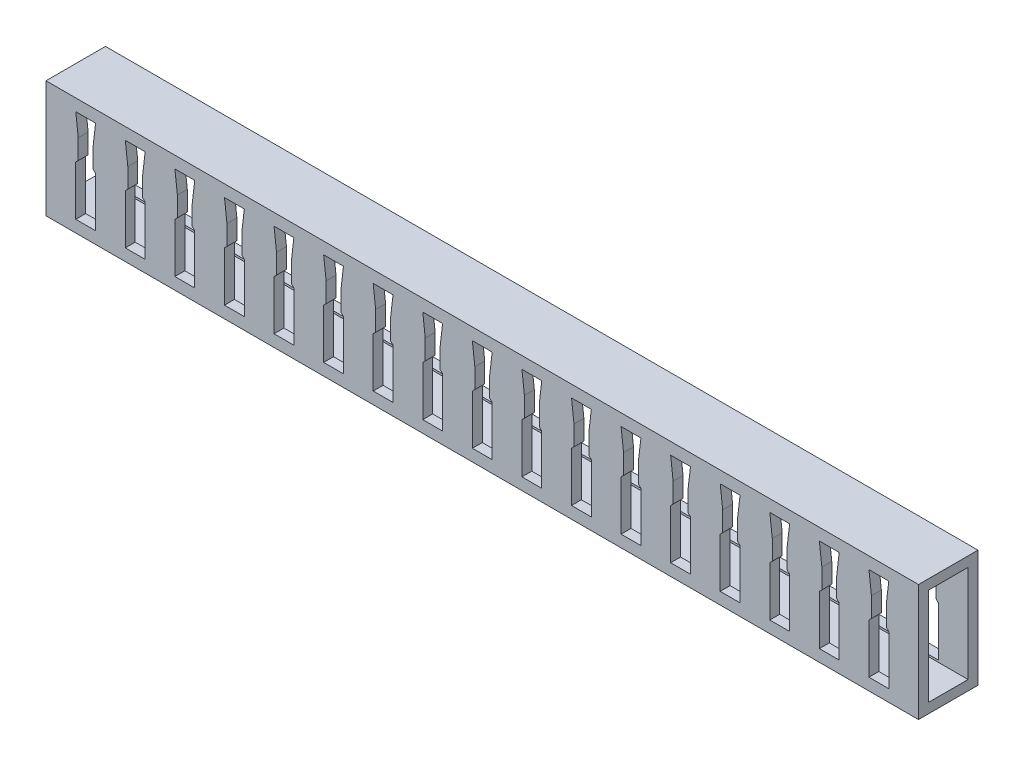
from build123d import *

# Parameters (mm, degrees)
SKETCH2_W           = 15.24
SKETCH2_H           = 29.972
BOSS_EXTRUDE1_DEPTH = 223.52
SKETCH3_W           = 10.16
SKETCH3_H           = 24.892
CUT_EXTRUDE1_DEPTH  = 419.1
CUT_EXTRUDE2_DEPTH  = 419.1


with BuildPart() as part:
    # Sketch2 → Boss-Extrude1 (new body)
    with BuildSketch(Plane(origin=(0, 0, 0), x_dir=(0, 0, -1), z_dir=(1, 0, 0))):
        with Locations((7.62, 14.986)):
            Rectangle(SKETCH2_W, SKETCH2_H)
    extrude(amount=BOSS_EXTRUDE1_DEPTH)

    # Sketch3 → Cut-Extrude1 (cut)
    with BuildSketch(Plane(origin=(223.52, 0, 0), x_dir=(0, 0, -1), z_dir=(1, 0, 0))):
        with Locations((7.62, 14.986)):
            Rectangle(SKETCH3_W, SKETCH3_H)
    extrude(amount=-CUT_EXTRUDE1_DEPTH, mode=Mode.SUBTRACT)

    # Sketch4 → Cut-Extrude2 (cut)
    with BuildSketch(Plane.XY):
        Polygon((7.62, 3.048), (7.62, 15.748), (8.255, 16.383), (8.255, 21.463), (7.62, 26.924), (12.7, 26.924), (12.065, 21.463), (12.065, 16.383), (12.7, 15.748), (12.7, 3.048), align=None)
        Polygon((25.4, 3.048), (20.32, 3.048), (20.32, 15.748), (20.955, 16.383), (20.955, 21.463), (20.32, 26.924), (25.4, 26.924), (24.765, 21.463), (24.765, 16.383), (25.4, 15.748), align=None)
        Polygon((38.1, 3.048), (33.02, 3.048), (33.02, 15.748), (33.655, 16.383), (33.655, 21.463), (33.02, 26.924), (38.1, 26.924), (37.465, 21.463), (37.465, 16.383), (38.1, 15.748), align=None)
        Polygon((50.8, 3.048), (45.72, 3.048), (45.72, 15.748), (46.355, 16.383), (46.355, 21.463), (45.72, 26.924), (50.8, 26.924), (50.165, 21.463), (50.165, 16.383), (50.8, 15.748), align=None)
        Polygon((63.5, 3.048), (58.42, 3.048), (58.42, 15.748), (59.055, 16.383), (59.055, 21.463), (58.42, 26.924), (63.5, 26.924), (62.865, 21.463), (62.865, 16.383), (63.5, 15.748), align=None)
        Polygon((76.2, 3.048), (71.12, 3.048), (71.12, 15.748), (71.755, 16.383), (71.755, 21.463), (71.12, 26.924), (76.2, 26.924), (75.565, 21.463), (75.565, 16.383), (76.2, 15.748), align=None)
        Polygon((88.9, 3.048), (83.82, 3.048), (83.82, 15.748), (84.455, 16.383), (84.455, 21.463), (83.82, 26.924), (88.9, 26.924), (88.265, 21.463), (88.265, 16.383), (88.9, 15.748), align=None)
        Polygon((101.6, 3.048), (96.52, 3.048), (96.52, 15.748), (97.155, 16.383), (97.155, 21.463), (96.52, 26.924), (101.6, 26.924), (100.965, 21.463), (100.965, 16.383), (101.6, 15.748), align=None)
        Polygon((114.3, 3.048), (109.22, 3.048), (109.22, 15.748), (109.855, 16.383), (109.855, 21.463), (109.22, 26.924), (114.3, 26.924), (113.665, 21.463), (113.665, 16.383), (114.3, 15.748), align=None)
        Polygon((127, 3.048), (121.92, 3.048), (121.92, 15.748), (122.555, 16.383), (122.555, 21.463), (121.92, 26.924), (127, 26.924), (126.365, 21.463), (126.365, 16.383), (127, 15.748), align=None)
        Polygon((139.7, 3.048), (134.62, 3.048), (134.62, 15.748), (135.255, 16.383), (135.255, 21.463), (134.62, 26.924), (139.7, 26.924), (139.065, 21.463), (139.065, 16.383), (139.7, 15.748), align=None)
        Polygon((152.4, 3.048), (147.32, 3.048), (147.32, 15.748), (147.955, 16.383), (147.955, 21.463), (147.32, 26.924), (152.4, 26.924), (151.765, 21.463), (151.765, 16.383), (152.4, 15.748), align=None)
        Polygon((165.1, 3.048), (160.02, 3.048), (160.02, 15.748), (160.655, 16.383), (160.655, 21.463), (160.02, 26.924), (165.1, 26.924), (164.465, 21.463), (164.465, 16.383), (165.1, 15.748), align=None)
        Polygon((177.8, 3.048), (172.72, 3.048), (172.72, 15.748), (173.355, 16.383), (173.355, 21.463), (172.72, 26.924), (177.8, 26.924), (177.165, 21.463), (177.165, 16.383), (177.8, 15.748), align=None)
        Polygon((190.5, 3.048), (185.42, 3.048), (185.42, 15.748), (186.055, 16.383), (186.055, 21.463), (185.42, 26.924), (190.5, 26.924), (189.865, 21.463), (189.865, 16.383), (190.5, 15.748), align=None)
        Polygon((203.2, 3.048), (198.12, 3.048), (198.12, 15.748), (198.755, 16.383), (198.755, 21.463), (198.12, 26.924), (203.2, 26.924), (202.565, 21.463), (202.565, 16.383), (203.2, 15.748), align=None)
        Polygon((215.9, 3.048), (210.82, 3.048), (210.82, 15.748), (211.455, 16.383), (211.455, 21.463), (210.82, 26.924), (215.9, 26.924), (215.265, 21.463), (215.265, 16.383), (215.9, 15.748), align=None)
        Polygon((228.6, 3.048), (223.52, 3.048), (223.52, 15.748), (224.155, 16.383), (224.155, 21.463), (223.52, 26.924), (228.6, 26.924), (227.965, 21.463), (227.965, 16.383), (228.6, 15.748), align=None)
        Polygon((241.3, 3.048), (236.22, 3.048), (236.22, 15.748), (236.855, 16.383), (236.855, 21.463), (236.22, 26.924), (241.3, 26.924), (240.665, 21.463), (240.665, 16.383), (241.3, 15.748), align=None)
        Polygon((254, 3.048), (248.92, 3.048), (248.92, 15.748), (249.555, 16.383), (249.555, 21.463), (248.92, 26.924), (254, 26.924), (253.365, 21.463), (253.365, 16.383), (254, 15.748), align=None)
        Polygon((266.7, 3.048), (261.62, 3.048), (261.62, 15.748), (262.255, 16.383), (262.255, 21.463), (261.62, 26.924), (266.7, 26.924), (266.065, 21.463), (266.065, 16.383), (266.7, 15.748), align=None)
        Polygon((279.4, 3.048), (274.32, 3.048), (274.32, 15.748), (274.955, 16.383), (274.955, 21.463), (274.32, 26.924), (279.4, 26.924), (278.765, 21.463), (278.765, 16.383), (279.4, 15.748), align=None)
        Polygon((292.1, 3.048), (287.02, 3.048), (287.02, 15.748), (287.655, 16.383), (287.655, 21.463), (287.02, 26.924), (292.1, 26.924), (291.465, 21.463), (291.465, 16.383), (292.1, 15.748), align=None)
        Polygon((304.8, 3.048), (299.72, 3.048), (299.72, 15.748), (300.355, 16.383), (300.355, 21.463), (299.72, 26.924), (304.8, 26.924), (304.165, 21.463), (304.165, 16.383), (304.8, 15.748), align=None)
        Polygon((317.5, 3.048), (312.42, 3.048), (312.42, 15.748), (313.055, 16.383), (313.055, 21.463), (312.42, 26.924), (317.5, 26.924), (316.865, 21.463), (316.865, 16.383), (317.5, 15.748), align=None)
        Polygon((330.2, 3.048), (325.12, 3.048), (325.12, 15.748), (325.755, 16.383), (325.755, 21.463), (325.12, 26.924), (330.2, 26.924), (329.565, 21.463), (329.565, 16.383), (330.2, 15.748), align=None)
        Polygon((342.9, 3.048), (337.82, 3.048), (337.82, 15.748), (338.455, 16.383), (338.455, 21.463), (337.82, 26.924), (342.9, 26.924), (342.265, 21.463), (342.265, 16.383), (342.9, 15.748), align=None)
        Polygon((355.6, 3.048), (350.52, 3.048), (350.52, 15.748), (351.155, 16.383), (351.155, 21.463), (350.52, 26.924), (355.6, 26.924), (354.965, 21.463), (354.965, 16.383), (355.6, 15.748), align=None)
        Polygon((368.3, 3.048), (363.22, 3.048), (363.22, 15.748), (363.855, 16.383), (363.855, 21.463), (363.22, 26.924), (368.3, 26.924), (367.665, 21.463), (367.665, 16.383), (368.3, 15.748), align=None)
        Polygon((381, 3.048), (375.92, 3.048), (375.92, 15.748), (376.555, 16.383), (376.555, 21.463), (375.92, 26.924), (381, 26.924), (380.365, 21.463), (380.365, 16.383), (381, 15.748), align=None)
        Polygon((393.7, 3.048), (388.62, 3.048), (388.62, 15.748), (389.255, 16.383), (389.255, 21.463), (388.62, 26.924), (393.7, 26.924), (393.065, 21.463), (393.065, 16.383), (393.7, 15.748), align=None)
        Polygon((406.4, 3.048), (401.32, 3.048), (401.32, 15.748), (401.955, 16.383), (401.955, 21.463), (401.32, 26.924), (406.4, 26.924), (405.765, 21.463), (405.765, 16.383), (406.4, 15.748), align=None)
    extrude(amount=-CUT_EXTRUDE2_DEPTH, mode=Mode.SUBTRACT)


solid = part.part
